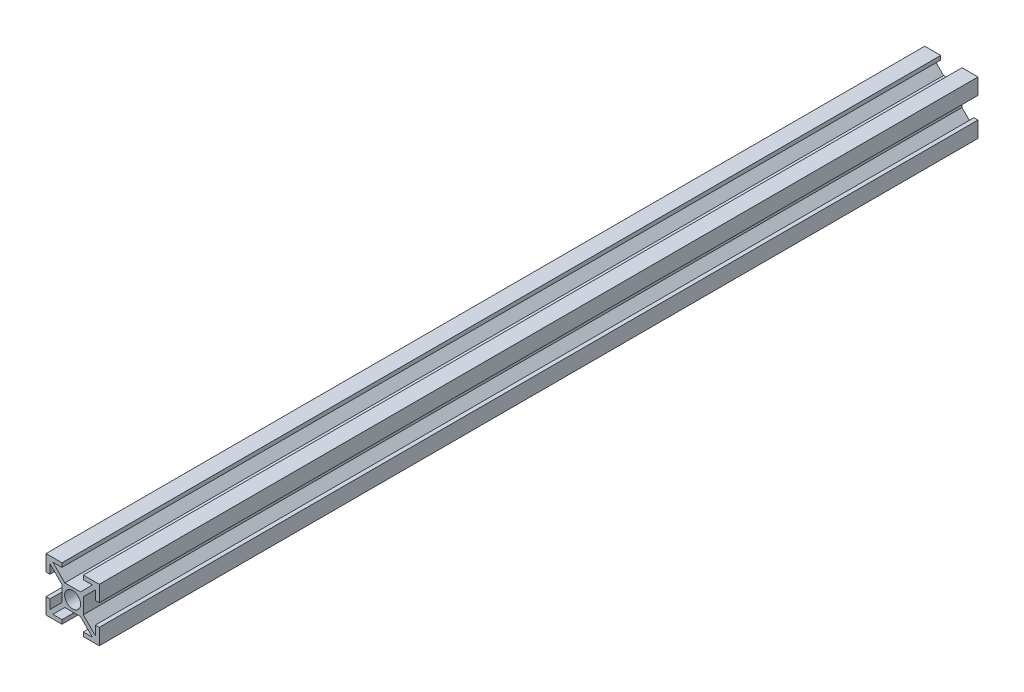
from build123d import *

# Parameters (mm, degrees)
ESBO_O1_R                = 3
RESSALTO_EXTRUS_O1_DEPTH = 330


with BuildPart() as part:
    # Esboço1 → Ressalto-extrusão1 (new body)
    with BuildSketch(Plane.XY):
        Polygon((-2.939339828, 4), (2.939339828, 4), (7.439339828, 8.5), (4, 8.5), (4, 10), (10, 10), (10, 4), (8.5, 4), (8.5, 7.439339828), (4, 2.939339828), (4, -2.939339828), (8.5, -7.439339828), (8.5, -4), (10, -4), (10, -10), (4, -10), (4, -8.5), (7.439339828, -8.5), (2.939339828, -4), (-2.939339828, -4), (-7.439339828, -8.5), (-4, -8.5), (-4, -10), (-10, -10), (-10, -4), (-8.5, -4), (-8.5, -7.439339828), (-4, -2.939339828), (-4, 2.939339828), (-8.5, 7.439339828), (-8.5, 4), (-10, 4), (-10, 10), (-4, 10), (-4, 8.5), (-7.439339828, 8.5), align=None)
        Circle(ESBO_O1_R, mode=Mode.SUBTRACT)
    extrude(amount=RESSALTO_EXTRUS_O1_DEPTH)


solid = part.part
